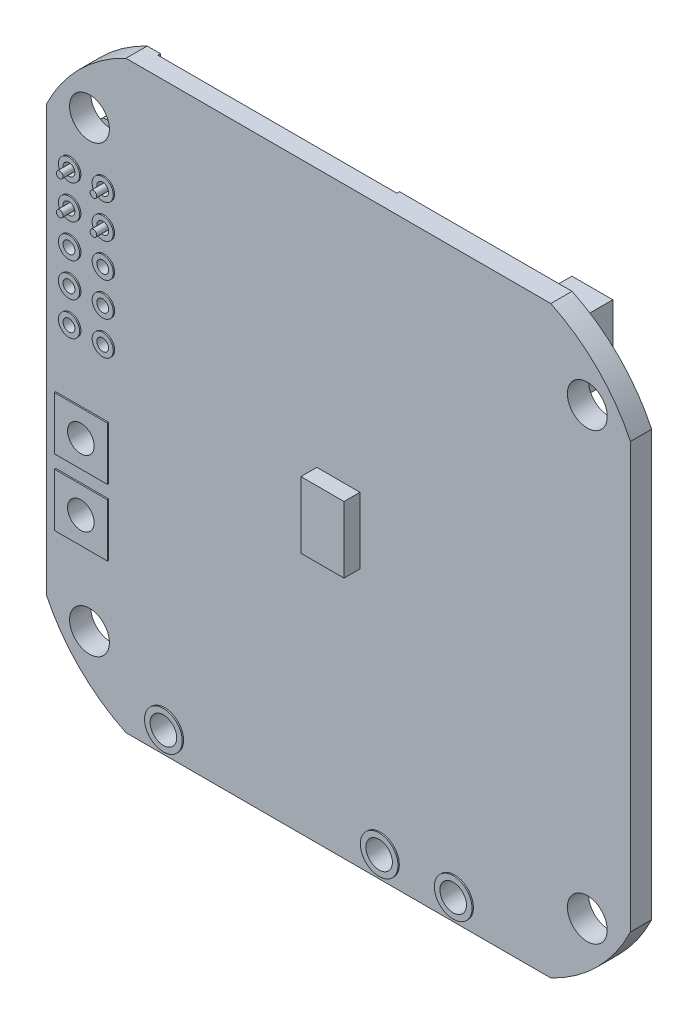
from build123d import *

# Parameters (mm, degrees)
SALIENTE_EXTRUIR1_DEPTH    = 0.8
CROQUIS2_R                 = 1.5
CORTAR_EXTRUIR1_DEPTH      = 32.153811966
CROQUIS3_W                 = 3.25
CROQUIS3_H                 = 5
SALIENTE_EXTRUIR2_DEPTH    = 1.2
CROQUIS4_R                 = 0.445
CORTAR_EXTRUIR2_DEPTH      = 32.238437861
CROQUIS5_R                 = 0.79739254
CROQUIS5_R_2               = 0.445
CROQUIS5_W                 = 4
CROQUIS5_H                 = 4
SALIENTE_EXTRUIR3_DEPTH    = 0.9
CORTAR_EXTRUIR3_DEPTH      = 32.247559905
CORTAR_EXTRUIR3_DEPTH_BACK = 32.247559905
CROQUIS6_R                 = 1
CROQUIS7_R                 = 1
CORTAR_EXTRUIR4_DEPTH      = 10
CROQUIS8_W                 = 3
CROQUIS8_H                 = 2.5
SALIENTE_EXTRUIR4_DEPTH    = 1.2
CROQUIS9_R                 = 0.75
SALIENTE_EXTRUIR5_DEPTH    = 0.8
CROQUIS10_W                = 5
CROQUIS10_H                = 5
SALIENTE_EXTRUIR6_DEPTH    = 0.9
SALIENTE_EXTRUIR7_START    = 0.1
CROQUIS11_R                = 1
SALIENTE_EXTRUIR7_DEPTH    = 0.1
SALIENTE_EXTRUIR8_DEPTH    = 0.75
CROQUIS13_W                = 3.080395022
CROQUIS13_H                = 5.233680862
SALIENTE_EXTRUIR9_DEPTH    = 2.65
CROQUIS14_W                = 3.82
CROQUIS14_H                = 3.82
SALIENTE_EXTRUIR10_DEPTH   = 3
CROQUIS30_R                = 1.419915385
CROQUIS30_R_2              = 1
SALIENTE_EXTRUIR17_DEPTH   = 0.1
CROQUIS29_W                = 3.5
CROQUIS29_H                = 1.5
SALIENTE_EXTRUIR16_DEPTH   = 0.5
CHAFL_N1_SIZE              = 1
CROQUIS31_W                = 18
CROQUIS31_H                = 19.35
CORTAR_EXTRUIR5_DEPTH      = 0.2
CROQUIS32_R                = 0.65
SALIENTE_EXTRUIR18_DEPTH   = 1.6
CROQUIS33_R                = 0.25
SALIENTE_EXTRUIR19_DEPTH   = 2.5
CROQUIS34_R                = 0.65
CROQUIS34_R_2              = 0.64
CROQUIS34_R_3              = 0.664142136
SALIENTE_EXTRUIR20_DEPTH   = 3


with BuildPart() as part:
    # Croquis1 → Saliente-Extruir1 (new, symmetric)
    with BuildSketch(Plane.XY):
        with BuildLine():
            Line((-22, 16), (-22, -16))
            ThreePointArc((-22, -16), (-19.513773424, -19.513773424), (-16, -22))
            Line((-16, -22), (16, -22))
            ThreePointArc((16, -22), (19.513773424, -19.513773424), (22, -16))
            Line((22, -16), (22, 16))
            ThreePointArc((22, 16), (19.513773424, 19.513773424), (16, 22))
            Line((16, 22), (-16, 22))
            ThreePointArc((-16, 22), (-19.513773424, 19.513773424), (-22, 16))
        make_face()
    extrude(amount=SALIENTE_EXTRUIR1_DEPTH, both=True)

    # Croquis2 → Cortar-Extruir1 (cut, through all)
    with BuildSketch(Plane.XY.offset(0.8)):
        with Locations((-18.75, 16.75)):
            Circle(CROQUIS2_R)
        with Locations((18.75, 16.75)):
            Circle(CROQUIS2_R)
        with Locations((18.75, -16.75)):
            Circle(CROQUIS2_R)
        with Locations((-18.75, -16.75)):
            Circle(CROQUIS2_R)
    extrude(amount=-CORTAR_EXTRUIR1_DEPTH, mode=Mode.SUBTRACT)

    # Croquis3 → Saliente-Extruir2 (add)
    with BuildSketch(Plane.XY.offset(0.8)):
        Rectangle(CROQUIS3_W, CROQUIS3_H)
    extrude(amount=SALIENTE_EXTRUIR2_DEPTH)

    # Croquis4 → Cortar-Extruir2 (cut, through all)
    with BuildSketch(Plane(origin=(0, 0, -0.8), x_dir=(-1, 0, 0), z_dir=(0, 0, -1))):
        with Locations((17.653, 12.7)):
            Circle(CROQUIS4_R)
        with Locations((20.193, 12.7)):
            Circle(CROQUIS4_R)
        with Locations((20.193, 10.16)):
            Circle(CROQUIS4_R)
        with Locations((20.193, 7.62)):
            Circle(CROQUIS4_R)
        with Locations((20.193, 5.08)):
            Circle(CROQUIS4_R)
        with Locations((20.193, 2.54)):
            Circle(CROQUIS4_R)
        with Locations((17.653, 10.16)):
            Circle(CROQUIS4_R)
        with Locations((17.653, 7.62)):
            Circle(CROQUIS4_R)
        with Locations((17.653, 5.08)):
            Circle(CROQUIS4_R)
        with Locations((17.653, 2.54)):
            Circle(CROQUIS4_R)
    extrude(amount=-CORTAR_EXTRUIR2_DEPTH, mode=Mode.SUBTRACT)

    # Croquis5 → Saliente-Extruir3 (add, symmetric)
    # profile 1 of 12: a face of its own
    with BuildSketch(Plane.XY):
        with Locations((-17.653, 2.54)):
            Circle(CROQUIS5_R)
        with Locations((-17.653, 2.54)):
            Circle(CROQUIS5_R_2, mode=Mode.SUBTRACT)
    # profile 2 of 12: a face of its own
    with BuildSketch(Plane.XY):
        with Locations((-20.193, 2.54)):
            Circle(CROQUIS5_R)
        with Locations((-20.193, 2.54)):
            Circle(CROQUIS5_R_2, mode=Mode.SUBTRACT)
    # profile 3 of 12: a face of its own
    with BuildSketch(Plane.XY):
        with Locations((-20.193, 5.08)):
            Circle(CROQUIS5_R)
        with Locations((-20.193, 5.08)):
            Circle(CROQUIS5_R_2, mode=Mode.SUBTRACT)
    # profile 4 of 12: a face of its own
    with BuildSketch(Plane.XY):
        with Locations((-17.653, 5.08)):
            Circle(CROQUIS5_R)
        with Locations((-17.653, 5.08)):
            Circle(CROQUIS5_R_2, mode=Mode.SUBTRACT)
    # profile 5 of 12: a face of its own
    with BuildSketch(Plane.XY):
        with Locations((-17.653, 7.62)):
            Circle(CROQUIS5_R)
        with Locations((-17.653, 7.62)):
            Circle(CROQUIS5_R_2, mode=Mode.SUBTRACT)
    # profile 6 of 12: a face of its own
    with BuildSketch(Plane.XY):
        with Locations((-17.653, 10.16)):
            Circle(CROQUIS5_R)
        with Locations((-17.653, 10.16)):
            Circle(CROQUIS5_R_2, mode=Mode.SUBTRACT)
    # profile 7 of 12: a face of its own
    with BuildSketch(Plane.XY):
        with Locations((-20.193, 7.62)):
            Circle(CROQUIS5_R)
        with Locations((-20.193, 7.62)):
            Circle(CROQUIS5_R_2, mode=Mode.SUBTRACT)
    # profile 8 of 12: a face of its own
    with BuildSketch(Plane.XY):
        with Locations((-20.193, 10.16)):
            Circle(CROQUIS5_R)
        with Locations((-20.193, 10.16)):
            Circle(CROQUIS5_R_2, mode=Mode.SUBTRACT)
    # profile 9 of 12: a face of its own
    with BuildSketch(Plane.XY):
        with Locations((-17.653, 12.7)):
            Circle(CROQUIS5_R)
        with Locations((-17.653, 12.7)):
            Circle(CROQUIS5_R_2, mode=Mode.SUBTRACT)
    # profile 10 of 12: a face of its own
    with BuildSketch(Plane.XY):
        with Locations((-20.193, 12.7)):
            Circle(CROQUIS5_R)
        with Locations((-20.193, 12.7)):
            Circle(CROQUIS5_R_2, mode=Mode.SUBTRACT)
    # profile 11 of 12: a face of its own
    with BuildSketch(Plane.XY):
        with Locations((-19.3, -4.4)):
            Rectangle(CROQUIS5_W, CROQUIS5_H)
    # profile 12 of 12: a face of its own
    with BuildSketch(Plane.XY):
        with Locations((-19.3, -9.4)):
            Rectangle(CROQUIS5_W, CROQUIS5_H)
    extrude(amount=SALIENTE_EXTRUIR3_DEPTH, both=True)

    # Croquis6 → Cortar-Extruir3 (cut, two sides: drawn at the far end of the back side and taken through both)
    with BuildSketch(Plane(origin=(0, 0, -0.9), x_dir=(-1, 0, 0), z_dir=(0, 0, -1)).offset(-CORTAR_EXTRUIR3_DEPTH_BACK)):
        with Locations((19.3, -4.4)):
            Circle(CROQUIS6_R)
        with Locations((19.3, -9.4)):
            Circle(CROQUIS6_R)
    extrude(amount=CORTAR_EXTRUIR3_DEPTH + CORTAR_EXTRUIR3_DEPTH_BACK, mode=Mode.SUBTRACT)

    # Croquis7 → Cortar-Extruir4 (cut)
    with BuildSketch(Plane(origin=(0, 0, -0.8), x_dir=(-1, 0, 0), z_dir=(0, 0, -1))):
        with Locations((-8.75, -20.32)):
            Circle(CROQUIS7_R)
        with Locations((-3.17, -20.32)):
            Circle(CROQUIS7_R)
        with Locations((13.08, -20.32)):
            Circle(CROQUIS7_R)
    extrude(amount=-CORTAR_EXTRUIR4_DEPTH, mode=Mode.SUBTRACT)

    # Croquis8 → Saliente-Extruir4 (add)
    with BuildSketch(Plane(origin=(0, 0, -0.8), x_dir=(-1, 0, 0), z_dir=(0, 0, -1))):
        with Locations((-19, 11.7)):
            Rectangle(CROQUIS8_W, CROQUIS8_H)
        with Locations((-19, 8.7)):
            Rectangle(CROQUIS8_W, CROQUIS8_H)
    extrude(amount=SALIENTE_EXTRUIR4_DEPTH)

    # Croquis9 → Saliente-Extruir5 (add)
    with BuildSketch(Plane(origin=(0, 0, -2), x_dir=(-1, 0, 0), z_dir=(0, 0, -1))):
        with Locations((-19, 11.7)):
            Circle(CROQUIS9_R)
        with Locations((-19, 8.7)):
            Circle(CROQUIS9_R)
    extrude(amount=SALIENTE_EXTRUIR5_DEPTH)

    # Croquis10 → Saliente-Extruir6 (add)
    with BuildSketch(Plane(origin=(0, 0, -0.8), x_dir=(-1, 0, 0), z_dir=(0, 0, -1))):
        with Locations((-13.5, -16.75)):
            Rectangle(CROQUIS10_W, CROQUIS10_H)
        with Locations((13.75, -14.7)):
            Rectangle(CROQUIS10_W, CROQUIS10_H)
        with Locations((8.387686328, -16.75)):
            Rectangle(CROQUIS10_W, CROQUIS10_H)
        with Locations((2.934297752, -16.75)):
            Rectangle(CROQUIS10_W, CROQUIS10_H)
        with Locations((-2.448267596, -14.7)):
            Rectangle(CROQUIS10_W, CROQUIS10_H)
        with Locations((-8.043302629, -14.7)):
            Rectangle(CROQUIS10_W, CROQUIS10_H)
    extrude(amount=SALIENTE_EXTRUIR6_DEPTH)

    # Croquis11 → Saliente-Extruir7 (add)
    # profile 1 of 3: a face of its own
    with BuildSketch(Plane(origin=(0, 0, -0.8), x_dir=(-1, 0, 0), z_dir=(0, 0, -1)).offset(SALIENTE_EXTRUIR7_START)):
        Polygon((-13.652894244, -19.522521794), (-10.45933095, -19.522521794), (-9.812366284, -18.875557129), (-7.528981863, -18.875557129), (-7.147566948, -19.256972043), (-7.147566948, -21.343674777), (-7.528981863, -21.725089692), (-13.830102074, -21.725089692), (-14.141358707, -21.413833058), (-14.141358707, -20.010986258), align=None)
        with Locations((-8.75, -20.32)):
            Circle(CROQUIS11_R, mode=Mode.SUBTRACT)
    # profile 2 of 3: a face of its own
    with BuildSketch(Plane(origin=(0, 0, -0.8), x_dir=(-1, 0, 0), z_dir=(0, 0, -1)).offset(SALIENTE_EXTRUIR7_START)):
        Polygon((8.172318821, -19.522521794), (11.198277852, -19.522521794), (12.022450347, -18.698349299), (14.296231203, -18.698349299), (14.77845979, -19.180577887), (14.77845979, -21.242861104), (14.296231203, -21.725089692), (7.995110992, -21.725089692), (7.683854358, -21.413833058), (7.683854358, -20.010986258), align=None)
        with Locations((13.08, -20.32)):
            Circle(CROQUIS11_R, mode=Mode.SUBTRACT)
    # profile 3 of 3: a face of its own
    with BuildSketch(Plane(origin=(0, 0, -0.8), x_dir=(-1, 0, 0), z_dir=(0, 0, -1)).offset(SALIENTE_EXTRUIR7_START)):
        Polygon((2.263089361, -20.010986258), (1.774624897, -19.522521794), (-1.418938397, -19.522521794), (-2.065903062, -18.875557129), (-4.349287484, -18.875557129), (-4.730702399, -19.256972043), (-4.730702399, -21.343674777), (-4.349287484, -21.725089692), (1.951832727, -21.725089692), (2.263089361, -21.413833058), align=None)
        with Locations((-3.17, -20.32)):
            Circle(CROQUIS11_R, mode=Mode.SUBTRACT)
    extrude(amount=-SALIENTE_EXTRUIR7_DEPTH)

    # Croquis12 → Saliente-Extruir8 (add)
    with BuildSketch(Plane(origin=(0, 0, -0.8), x_dir=(-1, 0, 0), z_dir=(0, 0, -1))):
        Polygon((-19.575208836, -2.789767852), (-13.48447481, -8.880501877), (-7.393740785, -2.789767852), (-13.48447481, 3.300966173), align=None)
    extrude(amount=SALIENTE_EXTRUIR8_DEPTH)

    # Croquis13 → Saliente-Extruir9 (add)
    with BuildSketch(Plane(origin=(0, 0, -0.8), x_dir=(-1, 0, 0), z_dir=(0, 0, -1))):
        with Locations((-14.88146784, 17.715085573)):
            Rectangle(CROQUIS13_W, CROQUIS13_H)
    extrude(amount=SALIENTE_EXTRUIR9_DEPTH)

    # Croquis14 → Saliente-Extruir10 (add)
    with BuildSketch(Plane(origin=(0, 0, -0.8), x_dir=(-1, 0, 0), z_dir=(0, 0, -1))):
        with Locations((-10.141101814, 15.498369959)):
            Rectangle(CROQUIS14_W, CROQUIS14_H)
    extrude(amount=SALIENTE_EXTRUIR10_DEPTH)

    # Croquis30 → Saliente-Extruir17 (add)
    # profile 1 of 3: a face of its own
    with BuildSketch(Plane.XY.offset(0.8)):
        with Locations((-13.08, -20.32)):
            Circle(CROQUIS30_R)
        with Locations(Location((-13.08, -20.32, 0), (0, 0, 180))):
            Circle(CROQUIS30_R_2, mode=Mode.SUBTRACT)
    # profile 2 of 3: a face of its own
    with BuildSketch(Plane.XY.offset(0.8)):
        with Locations((8.75, -20.32)):
            Circle(CROQUIS30_R)
        with Locations(Location((8.75, -20.32, 0), (0, 0, 180))):
            Circle(CROQUIS30_R_2, mode=Mode.SUBTRACT)
    # profile 3 of 3: a face of its own
    with BuildSketch(Plane.XY.offset(0.8)):
        with Locations((3.17, -20.32)):
            Circle(CROQUIS30_R)
        with Locations(Location((3.17, -20.32, 0), (0, 0, 180))):
            Circle(CROQUIS30_R_2, mode=Mode.SUBTRACT)
    extrude(amount=SALIENTE_EXTRUIR17_DEPTH)

    # Croquis29 → Saliente-Extruir16 (add)
    with BuildSketch(Plane(origin=(0, 0, -0.8), x_dir=(-1, 0, 0), z_dir=(0, 0, -1))):
        with Locations((12.25, 0.75)):
            Rectangle(CROQUIS29_W, CROQUIS29_H)
        with Locations((12.25, -1.4)):
            Rectangle(CROQUIS29_W, CROQUIS29_H)
        with Locations((4.5, 0.75)):
            Rectangle(CROQUIS29_W, CROQUIS29_H)
    extrude(amount=SALIENTE_EXTRUIR16_DEPTH)

    # Chaflán1
    chafl_n1_edges = [part.edges().sort_by_distance(p)[0] for p in [
        (12.051101814, 17.408369959, -2.3),
        (12.051101814, 13.588369959, -2.3),
        (8.231101814, 13.588369959, -2.3),
        (8.231101814, 17.408369959, -2.3),
    ]]
    chamfer(chafl_n1_edges, length=CHAFL_N1_SIZE)

    # Croquis31 → Cortar-Extruir5 (cut)
    with BuildSketch(Plane(origin=(0, 0, -0.8), x_dir=(-1, 0, 0), z_dir=(0, 0, -1))):
        with Locations((6, 12.325)):
            Rectangle(CROQUIS31_W, CROQUIS31_H)
    extrude(amount=-CORTAR_EXTRUIR5_DEPTH, mode=Mode.SUBTRACT)

    # Croquis32 → Saliente-Extruir18 (add)
    with BuildSketch(Plane(origin=(0, 0, -0.9), x_dir=(-1, 0, 0), z_dir=(0, 0, -1))):
        with Locations((17.653, 12.7)):
            Circle(CROQUIS32_R)
        with Locations((20.193, 12.7)):
            Circle(CROQUIS32_R)
        with Locations((20.193, 10.16)):
            Circle(CROQUIS32_R)
        with Locations((17.653, 10.16)):
            Circle(CROQUIS32_R)
    extrude(amount=SALIENTE_EXTRUIR18_DEPTH)

    # Croquis33 → Saliente-Extruir19 (add)
    with BuildSketch(Plane.XY.offset(-0.9)):
        with Locations(Location((-20.193, 12.7, 0), (0, 0, 180))):
            Circle(CROQUIS33_R)
        with Locations(Location((-17.653, 12.7, 0), (0, 0, 180))):
            Circle(CROQUIS33_R)
        with Locations(Location((-17.653, 10.16, 0), (0, 0, 180))):
            Circle(CROQUIS33_R)
        with Locations(Location((-20.193, 10.16, 0), (0, 0, 180))):
            Circle(CROQUIS33_R)
    extrude(amount=SALIENTE_EXTRUIR19_DEPTH)

    # Croquis34 → Saliente-Extruir20 (add)
    # profile 1 of 4: a face of its own
    with BuildSketch(Plane(origin=(0, 0, -2.5), x_dir=(-1, 0, 0), z_dir=(0, 0, -1))):
        Polygon((16.388, 13.490584967), (16.388, 11.920171354), (16.872841707, 11.435), (18.422628322, 11.435), (18.918, 11.909415033), (18.918, 13.490584967), (18.433158293, 13.965), (16.872841707, 13.965), align=None)
        with Locations((17.653, 12.7)):
            Circle(CROQUIS34_R, mode=Mode.SUBTRACT)
    # profile 2 of 4: a face of its own
    with BuildSketch(Plane(origin=(0, 0, -2.5), x_dir=(-1, 0, 0), z_dir=(0, 0, -1))):
        Polygon((18.96561914, 13.490584967), (18.96561914, 11.920171354), (19.450460847, 11.435), (21.000247463, 11.435), (21.49561914, 11.909415033), (21.49561914, 13.490584967), (21.010777434, 13.965), (19.450460847, 13.965), align=None)
        with Locations(Location((20.23061914, 12.7, 0), (0, 0, 76.201448094))):
            Circle(CROQUIS34_R_2, mode=Mode.SUBTRACT)
    # profile 3 of 4: a face of its own
    with BuildSketch(Plane(origin=(0, 0, -2.5), x_dir=(-1, 0, 0), z_dir=(0, 0, -1))):
        Polygon((18.96561914, 10.909416883), (18.96561914, 9.33900327), (19.450460847, 8.853831916), (21.000247463, 8.853831916), (21.49561914, 9.328246949), (21.49561914, 10.909416883), (21.010777434, 11.383831916), (19.450460847, 11.383831916), align=None)
        with Locations(Location((20.23061914, 10.118831916, 0), (0, 0, 205.390672838))):
            Circle(CROQUIS34_R_3, mode=Mode.SUBTRACT)
    # profile 4 of 4: a face of its own
    with BuildSketch(Plane(origin=(0, 0, -2.5), x_dir=(-1, 0, 0), z_dir=(0, 0, -1))):
        Polygon((16.388, 10.909416883), (16.388, 9.33900327), (16.872841707, 8.853831916), (18.422628322, 8.853831916), (18.918, 9.328246949), (18.918, 10.909416883), (18.433158293, 11.383831916), (16.872841707, 11.383831916), align=None)
        with Locations(Location((17.653, 10.118831916, 0), (0, 0, 192.277211152))):
            Circle(CROQUIS34_R_2, mode=Mode.SUBTRACT)
    extrude(amount=SALIENTE_EXTRUIR20_DEPTH)


with BuildPart() as saliente_extruir20_piece_1:
    # of the separate pieces the step leaves, piece 1, a body of its own (saliente_extruir20_pieces)
    add(part.part.solids().sort_by_distance((-16, 22, -0.8))[0])


with BuildPart() as saliente_extruir20_piece_2:
    # of the separate pieces the step leaves, piece 2, a body of its own (saliente_extruir20_pieces)
    add(part.part.solids().sort_by_distance((-18.303, 12.7, -5.5))[0])


solid = Compound([saliente_extruir20_piece_1.part, saliente_extruir20_piece_2.part])
